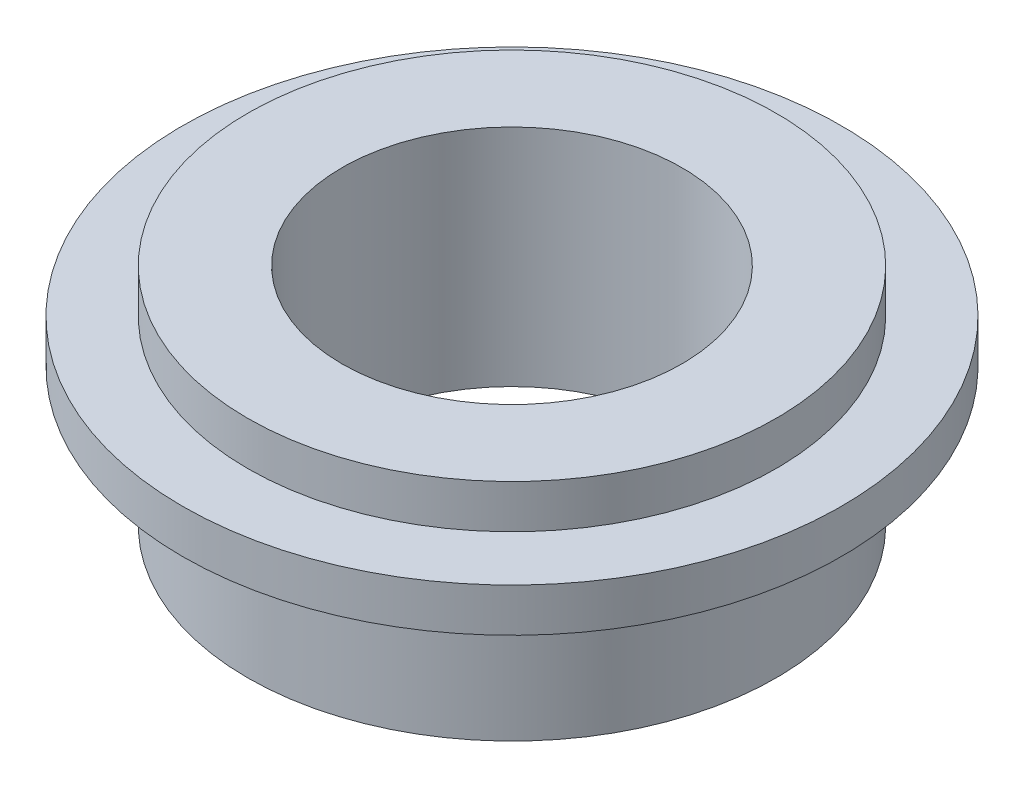
from build123d import *

# Parameters (mm, degrees)
RESSALTO_EXTRUS_O4_START = 1.5
ESBO_O6_R                = 22.720525956
ESBO_O6_R_2              = 18.220525956
RESSALTO_EXTRUS_O4_DEPTH = 1.5


with BuildPart() as part:
    # Esboço3 → Revolução2 (revolve)
    with BuildSketch(Plane.XY, mode=Mode.PRIVATE) as revolu_o2_sk:
        Polygon((-18.220525956, -9.945843652), (-11.720525956, -9.945843652), (-11.720525956, 5.554156348), (-18.220525956, 5.554156348), (-18.220525956, 2.554156348), (-22.720525956, 2.554156348), (-22.720525956, 1.054156348), (-18.220525956, 1.054156348), align=None)
    revolve(revolu_o2_sk.sketch.rotate(Axis((0, 11.544029698, 0), (0, -1, 0)), 270), axis=Axis((0, 11.544029698, 0), (0, -1, 0)))

    # Esboço6 → Ressalto-extrusão4 (add)
    with BuildSketch(Plane.XZ.offset(-1.054156348).offset(RESSALTO_EXTRUS_O4_START)):
        with Locations(Location((0, 0, 0), (0, 0, 90))):
            Circle(ESBO_O6_R)
        with Locations(Location((0, 0, 0), (0, 0, 90))):
            Circle(ESBO_O6_R_2, mode=Mode.SUBTRACT)
    extrude(amount=-RESSALTO_EXTRUS_O4_DEPTH)


solid = part.part
